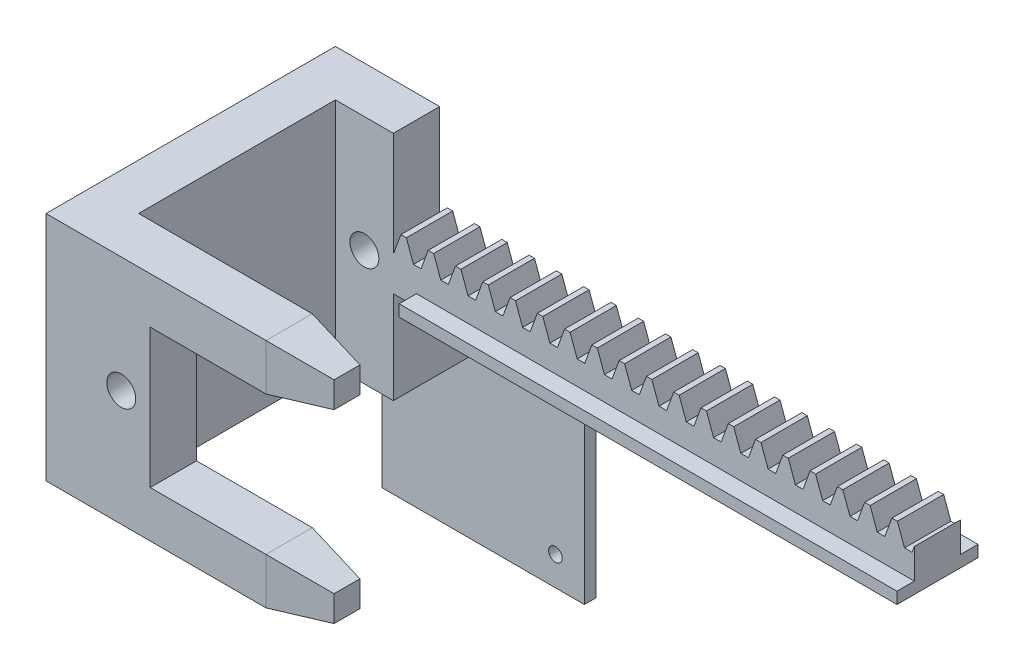
from build123d import *

# Parameters (mm, degrees)
BLANKSKE_W              = 100
BLANKSKE_H              = 9.5
BLANK_DEPTH             = 8
TOOTHCUTSIM_DEPTH       = 101.768298586
TEETHCUTS_COUNT         = 22
TEETHCUTS_PITCH         = 4.712388975
SKETCH1_W               = 3
SKETCH1_H               = 2
BOSS_EXTRUDE1_DEPTH     = 100
SKETCH4_W               = 50
SKETCH4_H               = 40
BOSS_EXTRUDE2_DEPTH     = 8
SKETCH5_W               = 8
SKETCH5_H               = 8
BOSS_EXTRUDE3_DEPTH     = 30
SKETCH6_W               = 8
SKETCH6_H               = 8
BOSS_EXTRUDE4_DEPTH     = 10
BOSS_EXTRUDE4_TAPER     = 10
SKETCH7_W               = 10
SKETCH7_H               = 24
EXTRUDE_THIN1_DEPTH     = 8
SKETCH8_W               = 10
SKETCH8_H               = 40
BOSS_EXTRUDE5_DEPTH     = 8
CUT_EXTRUDE1_REACH      = 112.671
SKETCH9_W               = 14
SKETCH9_H               = 3
CUT_EXTRUDE2_DEPTH      = 116.693560775
CUT_EXTRUDE2_DEPTH_BACK = 116.693560775
SKETCH10_R              = 2.5
SKETCH11_W              = 18
SKETCH11_H              = 5
BOSS_EXTRUDE6_DEPTH     = 10
SKETCH12_W              = 35
SKETCH12_H              = 2
BOSS_EXTRUDE7_DEPTH     = 30
CUT_EXTRUDE3_REACH      = 126.419
SKETCH13_R              = 1.18


with BuildPart() as part:
    # BlankSke → Blank (new body)
    with BuildSketch(Plane.XY):
        with Locations((50, 4.75)):
            Rectangle(BLANKSKE_W, BLANKSKE_H)
    extrude(amount=-BLANK_DEPTH)

    # TooCutSkeSim → ToothCutSim (cut, through all)
    with BuildSketch(Plane.XY):
        Polygon((0.654653055, 6.125), (-0.654653055, 6.125), (-1.892297439, 9.5254), (1.892297439, 9.5254), align=None)
    toothcutsim = extrude(amount=-TOOTHCUTSIM_DEPTH, mode=Mode.SUBTRACT)

    # TeethCuts: ToothCutSim ×22
    with Locations(*[(i * TEETHCUTS_PITCH, 0, 0) for i in range(1, TEETHCUTS_COUNT)]):
        add(toothcutsim, mode=Mode.SUBTRACT)

    # Sketch1 → Boss-Extrude1 (add)
    with BuildSketch(Plane.ZY):
        with Locations((1.5, 1)):
            Rectangle(SKETCH1_W, SKETCH1_H)
    boss_extrude1 = extrude(amount=-BOSS_EXTRUDE1_DEPTH)

    # Mirror1: Boss-Extrude1 across plane
    add(boss_extrude1.mirror(Plane(origin=(0, 0, -4), x_dir=(1, 0, 0), z_dir=(0, 0, -1))))

    # Sketch4 → Boss-Extrude2 (add)
    with BuildSketch(Plane.ZY):
        with Locations((17, 4)):
            Rectangle(SKETCH4_W, SKETCH4_H)
    extrude(amount=BOSS_EXTRUDE2_DEPTH)

    # Sketch5 → Boss-Extrude3 (add)
    with BuildSketch(Plane(origin=(0, 0, 0), x_dir=(0, 0, -1), z_dir=(1, 0, 0))):
        with Locations((-38, 20)):
            Rectangle(SKETCH5_W, SKETCH5_H)
    boss_extrude3 = extrude(amount=BOSS_EXTRUDE3_DEPTH)

    # Mirror2: Boss-Extrude3 across plane
    add(boss_extrude3.mirror(Plane.ZX.offset(4)))

    # Sketch6 → Boss-Extrude4 (add)
    with BuildSketch(Plane(origin=(30, 0, 0), x_dir=(0, 0, -1), z_dir=(1, 0, 0))):
        with Locations((-38, 20)):
            Rectangle(SKETCH6_W, SKETCH6_H)
    boss_extrude4 = extrude(amount=BOSS_EXTRUDE4_DEPTH, taper=BOSS_EXTRUDE4_TAPER)

    # Mirror3: Boss-Extrude4 across plane
    add(boss_extrude4.mirror(Plane.ZX.offset(4)))

    # Sketch7 → Extrude-Thin1 (add)
    with BuildSketch(Plane.XY.offset(42)):
        with Locations((5, 4)):
            Rectangle(SKETCH7_W, SKETCH7_H)
    extrude(amount=-EXTRUDE_THIN1_DEPTH)

    # Sketch8 → Boss-Extrude5 (add)
    with BuildSketch(Plane(origin=(0, 0, -8), x_dir=(-1, 0, 0), z_dir=(0, 0, -1))):
        with Locations((-5, 4)):
            Rectangle(SKETCH8_W, SKETCH8_H)
    extrude(amount=-BOSS_EXTRUDE5_DEPTH)

    # Sketch9 → Cut-Extrude1 (cut, up to next)
    with BuildSketch(Plane(origin=(0, 2, 0), x_dir=(1, 0, 0), z_dir=(0, 1, 0)), mode=Mode.PRIVATE) as cut_extrude1_sk1:
        with Locations((7, -1.5)):
            Rectangle(SKETCH9_W, SKETCH9_H)
    cut_extrude1_tool1 = extrude(cut_extrude1_sk1.sketch, amount=-CUT_EXTRUDE1_REACH, mode=Mode.PRIVATE) & part.part
    cut_extrude1 = cut_extrude1_tool1.solids().sort_by_distance((7, 2, 1.5))[0]
    add(cut_extrude1, mode=Mode.SUBTRACT)

    # Sketch10 → Cut-Extrude2 (cut, two sides: drawn at the far end of the back side and taken through both)
    with BuildSketch(Plane.XY.offset(42).offset(-CUT_EXTRUDE2_DEPTH_BACK)):
        with Locations((5, 4)):
            Circle(SKETCH10_R)
    extrude(amount=CUT_EXTRUDE2_DEPTH + CUT_EXTRUDE2_DEPTH_BACK, mode=Mode.SUBTRACT)

    # Mirror4: Cut-Extrude1 across plane
    add(cut_extrude1.mirror(Plane(origin=(0, 0, -4), x_dir=(1, 0, 0), z_dir=(0, 0, -1))), mode=Mode.SUBTRACT)

    # Sketch11 → Boss-Extrude6 (add)
    with BuildSketch(Plane(origin=(0, 0, -8), x_dir=(-1, 0, 0), z_dir=(0, 0, -1))):
        with Locations((-1, -13.5)):
            Rectangle(SKETCH11_W, SKETCH11_H)
    extrude(amount=BOSS_EXTRUDE6_DEPTH)

    # Sketch12 → Boss-Extrude7 (add)
    with BuildSketch(Plane(origin=(0, -16, 0), x_dir=(-1, 0, 0), z_dir=(0, -1, 0))):
        with Locations((-9.5, 17)):
            Rectangle(SKETCH12_W, SKETCH12_H)
    extrude(amount=BOSS_EXTRUDE7_DEPTH)

    # Sketch13 → Cut-Extrude3 (cut, up to next)
    with BuildSketch(Plane.XY.offset(-16), mode=Mode.PRIVATE) as cut_extrude3_sk1:
        with Locations((22, -41)):
            Circle(SKETCH13_R)
    cut_extrude3_tool1 = extrude(cut_extrude3_sk1.sketch, amount=-CUT_EXTRUDE3_REACH, mode=Mode.PRIVATE) & part.part
    add(cut_extrude3_tool1.solids().sort_by_distance((22, -41, -16))[0], mode=Mode.SUBTRACT)


solid = part.part
